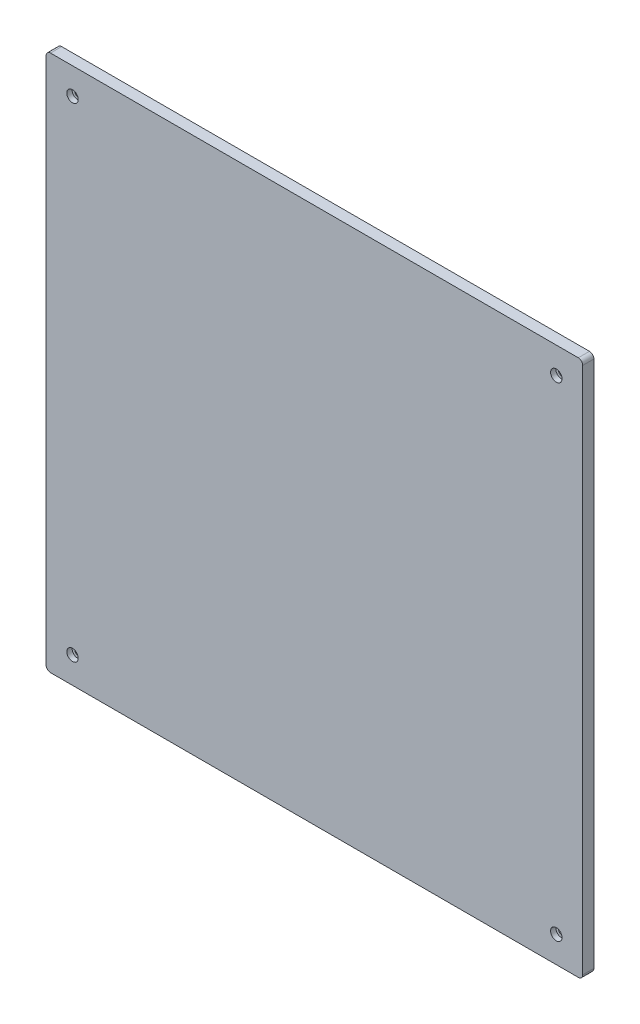
from build123d import *

# Parameters (mm, degrees)
SKETCH1_W                      = 304.8
SKETCH1_H                      = 304.8
BOSS_EXTRUDE1_DEPTH            = 6.35
CBORE_FOR_M3_SHCS1_D           = 3.4
CBORE_FOR_M3_SHCS1_CBORE_D     = 6.5
CBORE_FOR_M3_SHCS1_CBORE_DEPTH = 3
FILLET1_R                      = 2.5


with BuildPart() as part:
    # Sketch1 → Boss-Extrude1 (new body)
    with BuildSketch(Plane.XY):
        Rectangle(SKETCH1_W, SKETCH1_H)
    extrude(amount=BOSS_EXTRUDE1_DEPTH)

    # CBORE for M3 SHCS1 (through all)
    with Locations(Plane.XY.offset(6.35)):
        with Locations((137.4, 137.4), (-137.4, -137.4), (137.4, -137.4), (-137.4, 137.4)):
            CounterBoreHole(CBORE_FOR_M3_SHCS1_D / 2, CBORE_FOR_M3_SHCS1_CBORE_D / 2, CBORE_FOR_M3_SHCS1_CBORE_DEPTH)

    # Fillet1
    fillet1_edges = [part.edges().sort_by_distance(p)[0] for p in [
        (152.4, -152.4, 3.175),
        (-152.4, -152.4, 3.175),
        (-152.4, 152.4, 3.175),
        (152.4, 152.4, 3.175),
    ]]
    fillet(fillet1_edges, radius=FILLET1_R)


solid = part.part
